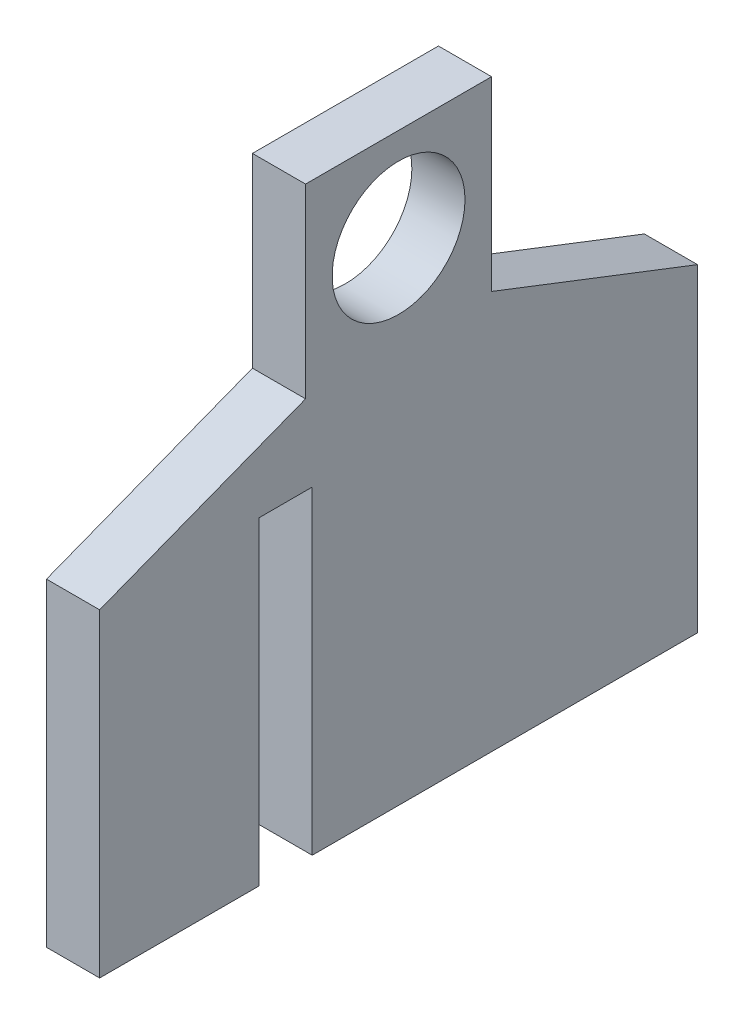
from build123d import *

# Parameters (mm, degrees)
SKETCH1_R           = 2.5
BOSS_EXTRUDE1_DEPTH = 2


with BuildPart() as part:
    # Sketch1 → Boss-Extrude1 (new body)
    with BuildSketch(Plane(origin=(0, 0, 0), x_dir=(0, 0, -1), z_dir=(1, 0, 0))):
        Polygon((-11.25, 0), (-5.25, 0), (-5.25, 12), (-3.25, 12), (-3.25, 0), (11.25, 0), (11.25, 12), (3.5, 15), (3.5, 22), (-3.5, 22), (-3.5, 15), (-11.25, 12), align=None)
        with Locations((0, 18.5)):
            Circle(SKETCH1_R, mode=Mode.SUBTRACT)
    extrude(amount=BOSS_EXTRUDE1_DEPTH)


solid = part.part
